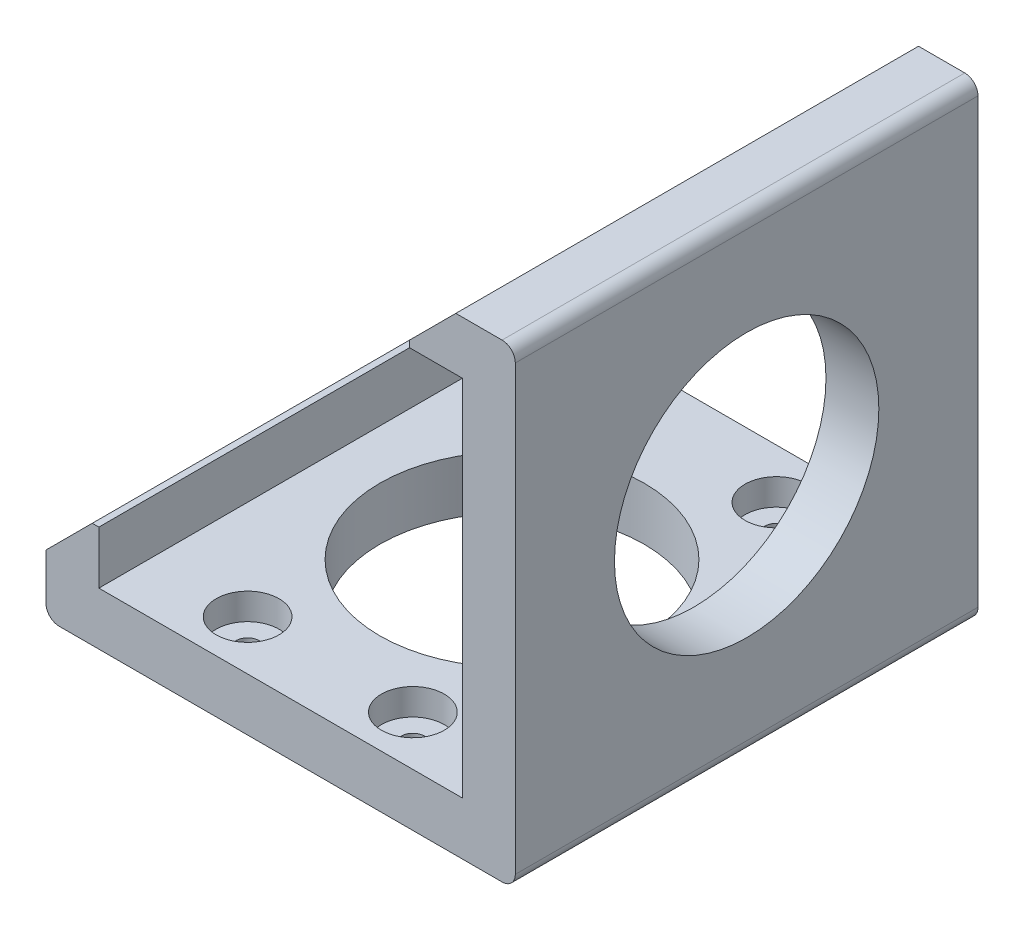
from build123d import *

# Parameters (mm, degrees)
BOSS_EXTRUDE1_DEPTH = 70
CHAMFER1_SIZE       = 7
FILLET1_R           = 2
SKETCH2_R           = 1.75
SKETCH2_R_2         = 20
CUT_EXTRUDE1_DEPTH  = 23
CUT_EXTRUDE2_START  = -4
SKETCH3_R           = 4.75
SKETCH3_R_2         = 1.75
CUT_EXTRUDE2_DEPTH  = 4
SKETCH5_R           = 20
CUT_EXTRUDE3_DEPTH  = 23


with BuildPart() as part:
    # Sketch1 → Boss-Extrude1 (new body)
    with BuildSketch(Plane.XY):
        Polygon((-55, 0), (0, 0), (0, 55), (-8, 55), (-8, 63), (8, 63), (8, -8), (-63, -8), (-63, 8), (-55, 8), align=None)
    extrude(amount=BOSS_EXTRUDE1_DEPTH)

    # Chamfer1
    chamfer1_edges = [part.edges().sort_by_distance(p)[0] for p in [
        (-8, 63, 35),
        (-63, 8, 35),
    ]]
    chamfer(chamfer1_edges, length=CHAMFER1_SIZE)

    # Fillet1
    fillet1_edges = [part.edges().sort_by_distance(p)[0] for p in [
        (8, 63, 35),
        (8, -8, 35),
        (-63, -8, 35),
    ]]
    fillet(fillet1_edges, radius=FILLET1_R)

    # Sketch2 → Cut-Extrude1 (cut)
    with BuildSketch(Plane.XZ.offset(8)):
        with Locations(Location((-40, 62.5, 0), (0, 0, 270))):
            Circle(SKETCH2_R)
        with Locations(Location((-15, 62.5, 0), (0, 0, 270))):
            Circle(SKETCH2_R)
        with Locations(Location((-15, 7.5, 0), (0, 0, 270))):
            Circle(SKETCH2_R)
        with Locations(Location((-40, 7.5, 0), (0, 0, 270))):
            Circle(SKETCH2_R)
        with Locations(Location((-27.5, 35, 0), (0, 0, 270))):
            Circle(SKETCH2_R_2)
    extrude(amount=-CUT_EXTRUDE1_DEPTH, mode=Mode.SUBTRACT)

    # Sketch3 → Cut-Extrude2 (cut)
    # profile 1 of 4: a face of its own
    with BuildSketch(Plane(origin=(0, 0, 0), x_dir=(1, 0, 0), z_dir=(0, 1, 0)).offset(CUT_EXTRUDE2_START)):
        with Locations(Location((-40, -62.5, 0), (0, 0, 270))):
            Circle(SKETCH3_R)
        with Locations(Location((-40, -62.5, 0), (0, 0, 90))):
            Circle(SKETCH3_R_2, mode=Mode.SUBTRACT)
    # profile 2 of 4: a face of its own
    with BuildSketch(Plane(origin=(0, 0, 0), x_dir=(1, 0, 0), z_dir=(0, 1, 0)).offset(CUT_EXTRUDE2_START)):
        with Locations(Location((-15, -62.5, 0), (0, 0, 270))):
            Circle(SKETCH3_R)
        with Locations(Location((-15, -62.5, 0), (0, 0, 90))):
            Circle(SKETCH3_R_2, mode=Mode.SUBTRACT)
    # profile 3 of 4: a face of its own
    with BuildSketch(Plane(origin=(0, 0, 0), x_dir=(1, 0, 0), z_dir=(0, 1, 0)).offset(CUT_EXTRUDE2_START)):
        with Locations(Location((-15, -7.5, 0), (0, 0, 270))):
            Circle(SKETCH3_R)
        with Locations(Location((-15, -7.5, 0), (0, 0, 90))):
            Circle(SKETCH3_R_2, mode=Mode.SUBTRACT)
    # profile 4 of 4: a face of its own
    with BuildSketch(Plane(origin=(0, 0, 0), x_dir=(1, 0, 0), z_dir=(0, 1, 0)).offset(CUT_EXTRUDE2_START)):
        with Locations(Location((-40, -7.5, 0), (0, 0, 270))):
            Circle(SKETCH3_R)
        with Locations(Location((-40, -7.5, 0), (0, 0, 90))):
            Circle(SKETCH3_R_2, mode=Mode.SUBTRACT)
    extrude(amount=CUT_EXTRUDE2_DEPTH, mode=Mode.SUBTRACT)

    # Sketch5 → Cut-Extrude3 (cut)
    with BuildSketch(Plane(origin=(8, 0, 0), x_dir=(0, 0, -1), z_dir=(1, 0, 0))):
        with Locations((-35, 27.5)):
            Circle(SKETCH5_R)
    extrude(amount=-CUT_EXTRUDE3_DEPTH, mode=Mode.SUBTRACT)


solid = part.part
